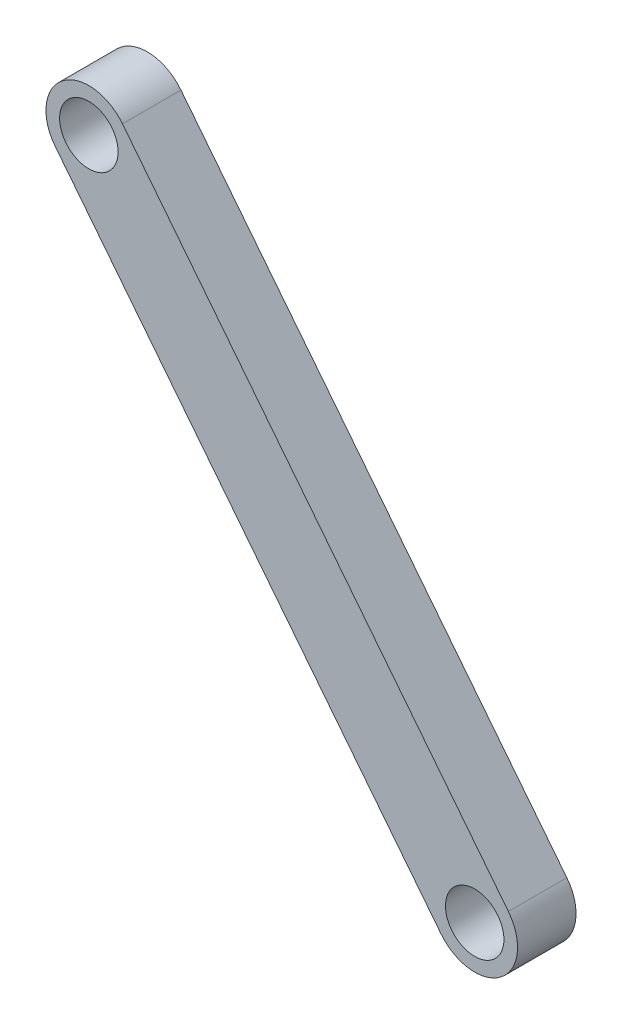
from build123d import *

# Parameters (mm, degrees)
ESQUISSE1_R        = 1.5
BOSS_EXTRU_1_DEPTH = 3


with BuildPart() as part:
    # Esquisse1 → Boss.-Extru.1 (new body)
    with BuildSketch(Plane.XY):
        with BuildLine():
            Line((1.727270402, 1.362547966), (21.527270402, -23.737452034))
            ThreePointArc((21.527270402, -23.737452034), (21.162547966, -26.827270402), (18.072729598, -26.462547966))
            Line((18.072729598, -26.462547966), (-1.727270402, -1.362547966))
            ThreePointArc((-1.727270402, -1.362547966), (-1.362547966, 1.727270402), (1.727270402, 1.362547966))
        make_face()
        Circle(ESQUISSE1_R, mode=Mode.SUBTRACT)
        with Locations((19.8, -25.1)):
            Circle(ESQUISSE1_R, mode=Mode.SUBTRACT)
    extrude(amount=BOSS_EXTRU_1_DEPTH)


solid = part.part
